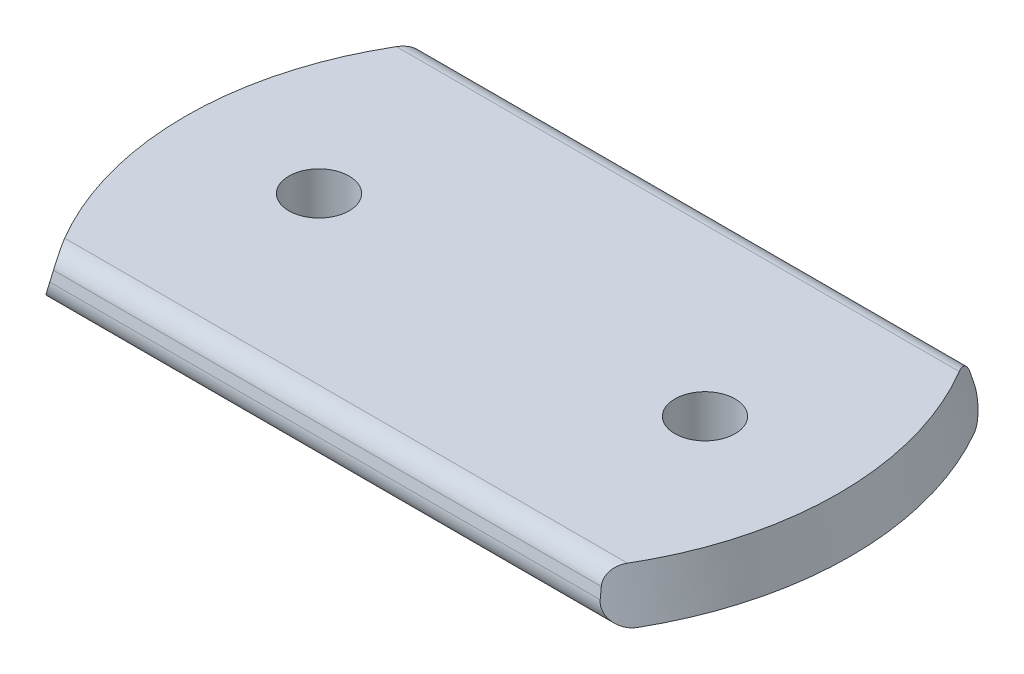
from build123d import *

# Parameters (mm, degrees)
BOSS_EXTRUDE1_DEPTH                 = 0.635
BOSS_EXTRUDE1_TAPER                 = 14
F_1_32_0_03125_DIAMETER_HOLE1_D     = 0.79375
F_1_32_0_03125_DIAMETER_HOLE1_DEPTH = 12.7
F_1_32_0_03125_DIAMETER_HOLE1_TIP   = 0.238466558
FILLET1_R                           = 0.254


with BuildPart() as part:
    # Sketch1 → Boss-Extrude1 (new body)
    with BuildSketch(Plane(origin=(0, 0, 0), x_dir=(1, 0, 0), z_dir=(0, 1, 0))):
        with BuildLine():
            Line((-3.66326211, -2.54), (3.66326211, -2.54))
            ThreePointArc((3.66326211, -2.54), (4.4577, 0), (3.66326211, 2.54))
            Line((3.66326211, 2.54), (-3.66326211, 2.54))
            ThreePointArc((-3.66326211, 2.54), (-4.4577, 0), (-3.66326211, -2.54))
        make_face()
    extrude(amount=BOSS_EXTRUDE1_DEPTH, taper=BOSS_EXTRUDE1_TAPER)

    # 1/32 (0.03125) Diameter Hole1
    with Locations(Plane(origin=(0, 0, 0), x_dir=(-1, 0, 0), z_dir=(0, -1, 0))):
        with Locations((2.54, 0), (-2.54, 0)):
            Hole(F_1_32_0_03125_DIAMETER_HOLE1_D / 2, depth=F_1_32_0_03125_DIAMETER_HOLE1_DEPTH)
            with Locations((0, 0, -(F_1_32_0_03125_DIAMETER_HOLE1_DEPTH + F_1_32_0_03125_DIAMETER_HOLE1_TIP / 2))):  # 118° drill point
                Cone(0, F_1_32_0_03125_DIAMETER_HOLE1_D / 2, F_1_32_0_03125_DIAMETER_HOLE1_TIP, mode=Mode.SUBTRACT)

    # Fillet1
    fillet1_edges = [part.edges().sort_by_distance(p)[0] for p in [
        (0, 0, -2.54),
        (0, 0.635, -2.381676718),
        (0, 0, 2.54),
        (0, 0.635, 2.381676718),
    ]]
    fillet(fillet1_edges, radius=FILLET1_R)


solid = part.part
